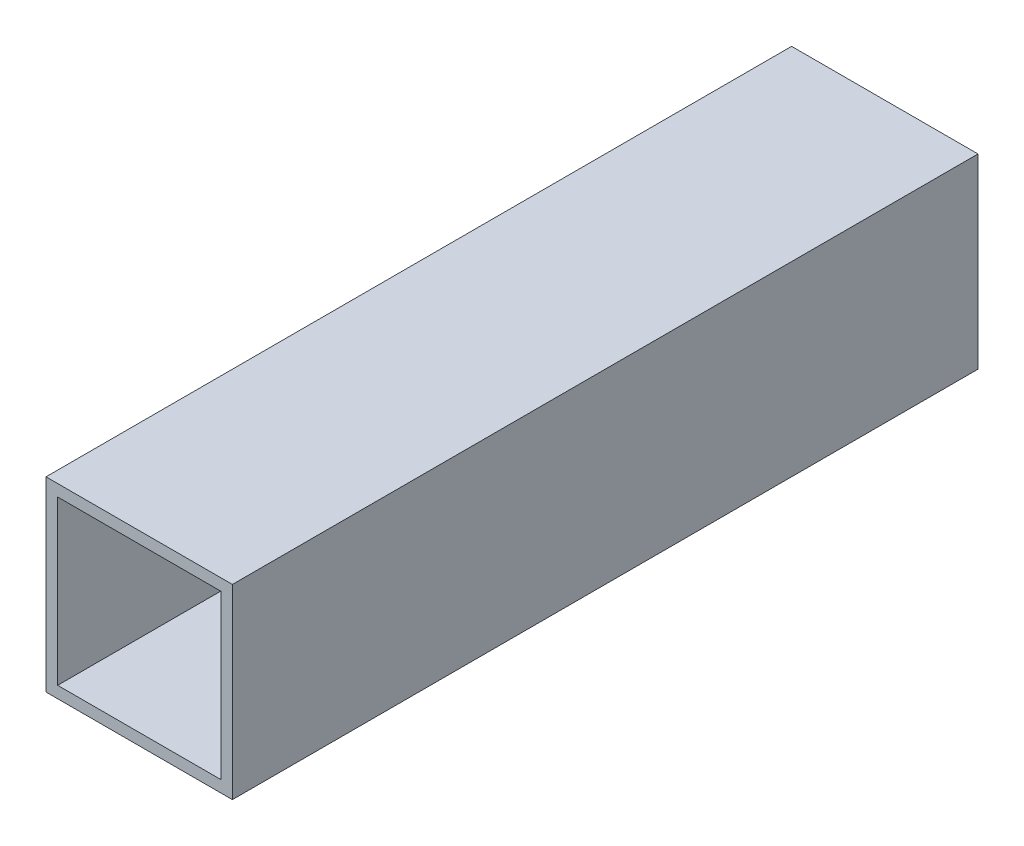
from build123d import *

# Parameters (mm, degrees)
SKETCH1_W           = 25.4
SKETCH1_H           = 25.4
SKETCH1_W_2         = 22.225
SKETCH1_H_2         = 22.225
BOSS_EXTRUDE1_DEPTH = 101.6


with BuildPart() as part:
    # Sketch1 → Boss-Extrude1 (new body)
    with BuildSketch(Plane.XY):
        Rectangle(SKETCH1_W, SKETCH1_H)
        Rectangle(SKETCH1_W_2, SKETCH1_H_2, mode=Mode.SUBTRACT)
    extrude(amount=BOSS_EXTRUDE1_DEPTH)


solid = part.part
